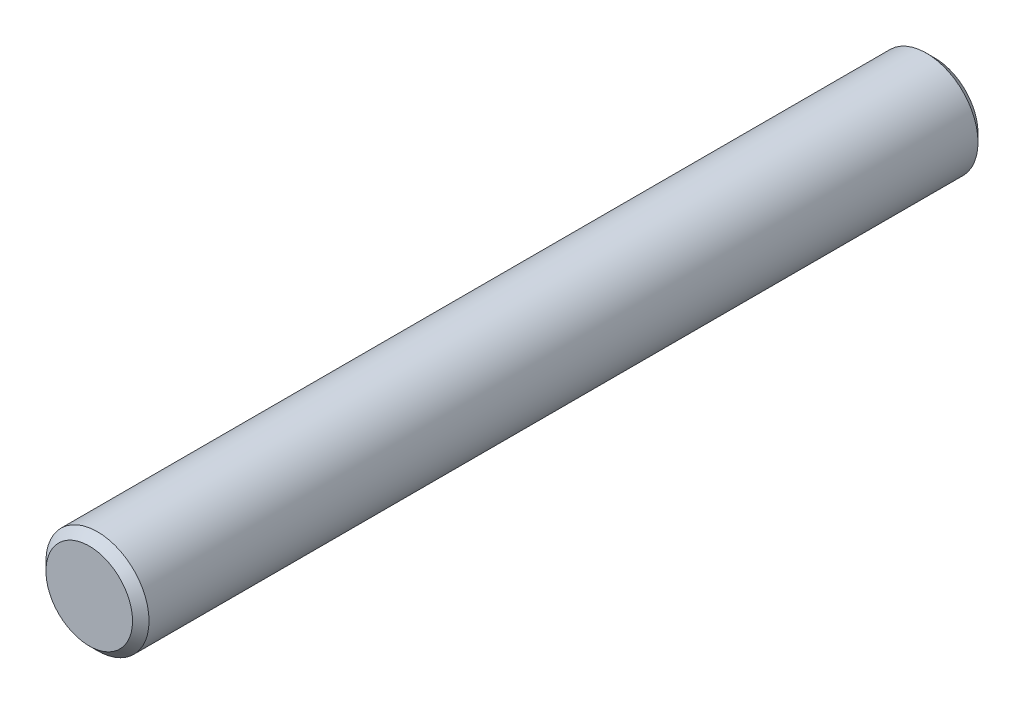
from build123d import *

# Parameters (mm, degrees)
SKETCH1_R           = 6.35
BOSS_EXTRUDE1_DEPTH = 104.14
CHAMFER1_SIZE       = 1.016


with BuildPart() as part:
    # Sketch1 → Boss-Extrude1 (new body)
    with BuildSketch(Plane.XY):
        Circle(SKETCH1_R)
    extrude(amount=BOSS_EXTRUDE1_DEPTH)

    # Chamfer1
    chamfer1_edges = [part.edges().sort_by_distance(p)[0] for p in [
        (-6.35, 0, 0),
        (-6.35, 0, 104.14),
    ]]
    chamfer(chamfer1_edges, length=CHAMFER1_SIZE)


solid = part.part
